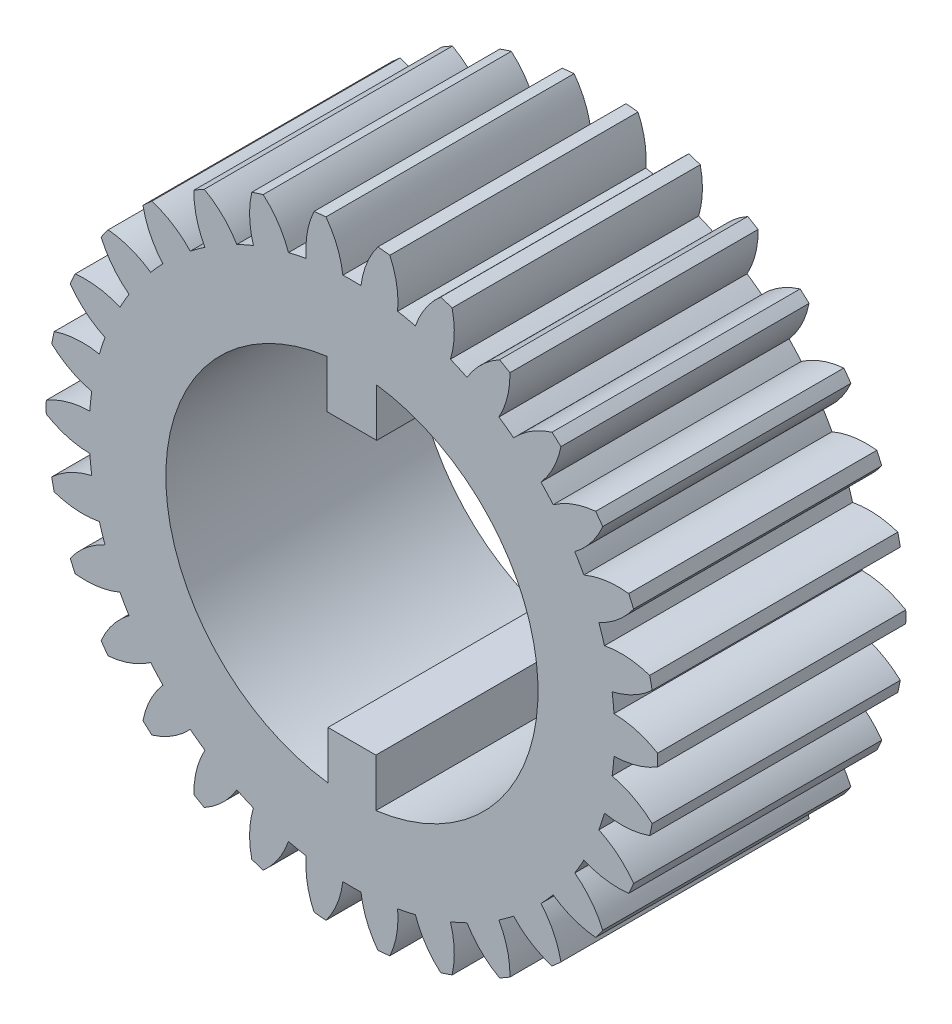
from build123d import *

# Parameters (mm, degrees)
SKETCH_1_R               = 12.32
EXTRUDE_1_DEPTH          = 5
PATTERN_CIRCULAR_1_COUNT = 30
CUT_EXTRUDE_1_DEPTH      = 10


with BuildPart() as part:
    # Эскиз1 → Бобышка-Вытянуть1 (new, symmetric)
    with BuildSketch(Plane.XY):
        Circle(SKETCH_1_R)
    extrude(amount=EXTRUDE_1_DEPTH, both=True)

    # Эскиз5 for Вырез-По сечениям1 → Вырез-По сечениям1 section 0
    with BuildSketch(Plane.XY.offset(-5)):
        with BuildLine():
            # circular arc as an exact rational Bezier (weights 1, cos(half-angle), 1)
            Bezier((-1.458691761, 12.736742847), (-0.522105639, 11.856767026), (-0.365824723, 10.581178031), weights=[1, 0.940287899, 1])
            Bezier((-0.365824723, 10.581178031), (0, 10.593825746), (0.365824723, 10.581178031), weights=[1, 0.999402884, 1])
            Bezier((0.365824723, 10.581178031), (0.522105639, 11.856767026), (1.458691761, 12.736742847), weights=[1, 0.940287899, 1])
            Bezier((1.458691761, 12.736742847), (0, 12.903801386), (-1.458691761, 12.736742847), weights=[1, 0.993505682, 1])
        make_face()
    # Эскиз2 for Вырез-По сечениям1 → Вырез-По сечениям1 section 1
    with BuildSketch(Plane.XY.offset(5)):
        with BuildLine():
            Bezier((-1.458691761, 12.736742847), (-0.522105639, 11.856767026), (-0.365824723, 10.581178031), weights=[1, 0.940287899, 1])
            Bezier((-0.365824723, 10.581178031), (0, 10.593825746), (0.365824723, 10.581178031), weights=[1, 0.999402884, 1])
            Bezier((0.365824723, 10.581178031), (0.522105639, 11.856767026), (1.458691761, 12.736742847), weights=[1, 0.940287899, 1])
            Bezier((1.458691761, 12.736742847), (0, 12.903801386), (-1.458691761, 12.736742847), weights=[1, 0.993505682, 1])
        make_face()
    loft_1 = loft(mode=Mode.SUBTRACT)

    # Круговой массив1: Вырез-По сечениям1 ×30 about axis
    pattern_circular_1_axis = Axis((0, 0, 0), (0, 0, 1))
    for i in range(1, PATTERN_CIRCULAR_1_COUNT):
        add(loft_1.rotate(pattern_circular_1_axis, i * 360 / PATTERN_CIRCULAR_1_COUNT), mode=Mode.SUBTRACT)

    # Эскиз6 → Вырез-Вытянуть1 (cut)
    with BuildSketch(Plane.XY.offset(5)):
        with BuildLine():
            Line((-1, 5.5), (-1, 7.433034374))
            ThreePointArc((-1, 7.433034374), (-7.499979055, -0.01772498), (-0.964855492, -7.43767799))
            Line((-0.964855492, -7.43767799), (-0.964855492, -5.5))
            Line((-0.964855492, -5.5), (0.964855492, -5.5))
            Line((0.964855492, -5.5), (0.964855492, -7.43767799))
            ThreePointArc((0.964855492, -7.43767799), (5.634111118, -4.950433507), (7.5, 0))
            ThreePointArc((7.5, 0), (5.645794895, 4.937104415), (1, 7.433034374))
            Line((1, 7.433034374), (1, 5.5))
            Line((1, 5.5), (-1, 5.5))
        make_face()
    extrude(amount=-CUT_EXTRUDE_1_DEPTH, mode=Mode.SUBTRACT)


solid = part.part
